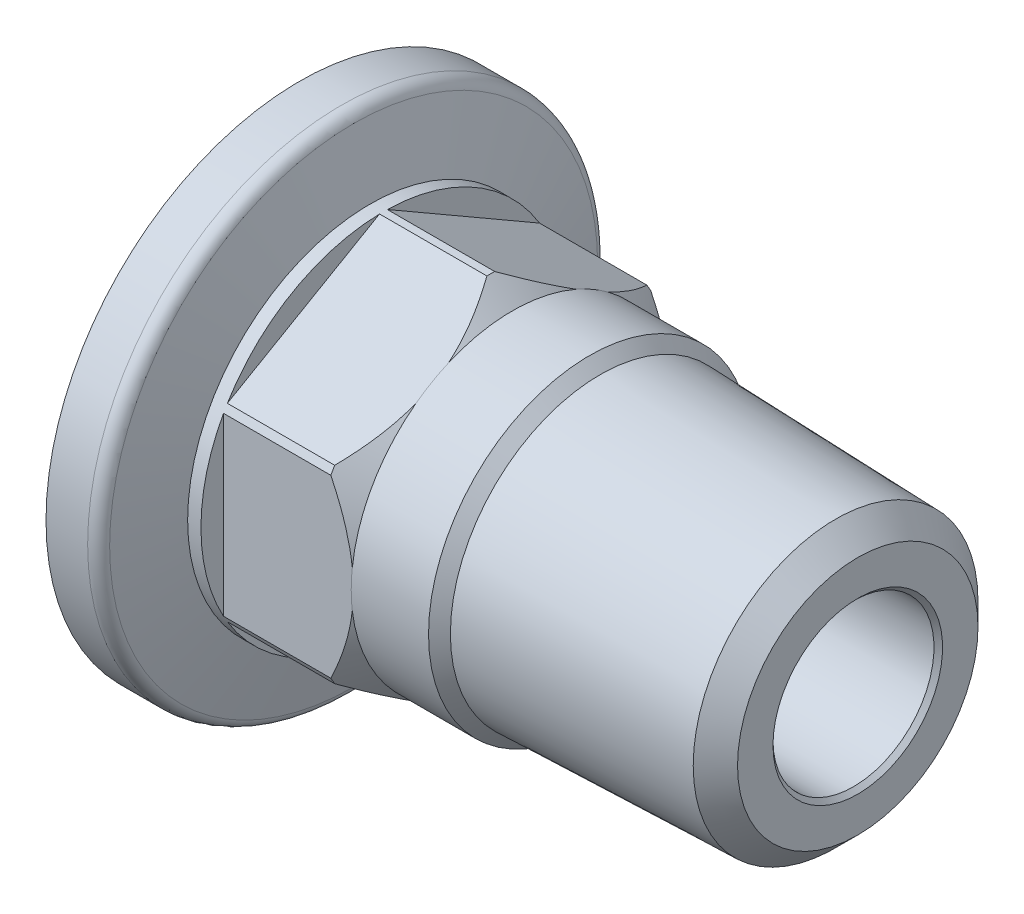
from build123d import *

# Parameters (mm, degrees)
CHAMFER2_SIZE      = 1.27
CHAMFER2_SIZE2     = 1.311607448
SKETCH13_OUTSIDE_W = 42.75
SKETCH13_OUTSIDE_H = 42.75
CUT_EXTRUDE3_DEPTH = 7.62
CHAMFER3_SIZE      = 0.254


with BuildPart() as part:
    # Sketch1 → Revolve1 (revolve)
    with BuildSketch(Plane.XY, mode=Mode.PRIVATE) as revolve1_sk:
        with BuildLine():
            Line((2.463296835, 14.9987), (0, 14.9987))
            Line((0, 14.9987), (0, 8.636))
            Line((0, 8.636), (2.6162, 8.636))
            Line((2.6162, 8.636), (2.6162, 4.7625))
            Line((2.6162, 4.7625), (33.02, 4.7625))
            Line((33.02, 4.7625), (33.02, 8.382))
            Line((33.02, 8.382), (17.78, 8.858247176))
            Line((17.78, 8.858247176), (17.153656205, 9.525))
            Line((17.153656205, 9.525), (12.581656205, 9.525))
            Line((12.581656205, 9.525), (11.311656205, 10.795))
            Line((11.311656205, 10.795), (4.17437802, 10.795))
            Line((4.17437802, 10.795), (3.199332315, 14.433920112))
            ThreePointArc((3.199332315, 14.433920112), (2.927173044, 14.841235245), (2.463296835, 14.9987))
        make_face()
    revolve(revolve1_sk.sketch.rotate(Axis((0, 0, 0), (1, 0, 0)), 90), axis=Axis((0, 0, 0), (1, 0, 0)))

    # Chamfer2
    chamfer2_edges = [part.edges().sort_by_distance(p)[0] for p in [
        (33.02, 0, -8.382),
    ]]
    chamfer2_side = [part.faces().sort_by_distance(p)[0] for p in [
        (33.02, 0, -4.999578762),
    ]]
    chamfer(chamfer2_edges, length=CHAMFER2_SIZE, length2=CHAMFER2_SIZE2, reference=chamfer2_side[0])

    # Sketch13 outside → Cut-Extrude3 (cut)
    with BuildSketch(Plane(origin=(12.581656205, 0, 0), x_dir=(0, 0, -1), z_dir=(1, 0, 0))):
        Rectangle(SKETCH13_OUTSIDE_W, SKETCH13_OUTSIDE_H)
        Polygon((0, 10.925199144), (-9.4615, 5.462599572), (-9.4615, -5.462599572), (0, -10.925199144), (9.4615, -5.462599572), (9.4615, 5.462599572), align=None, mode=Mode.SUBTRACT)
    extrude(amount=-CUT_EXTRUDE3_DEPTH, mode=Mode.SUBTRACT)

    # Chamfer3
    chamfer3_edges = [part.edges().sort_by_distance(p)[0] for p in [
        (33.02, 0, -4.7625),
    ]]
    chamfer(chamfer3_edges, length=CHAMFER3_SIZE)


solid = part.part
